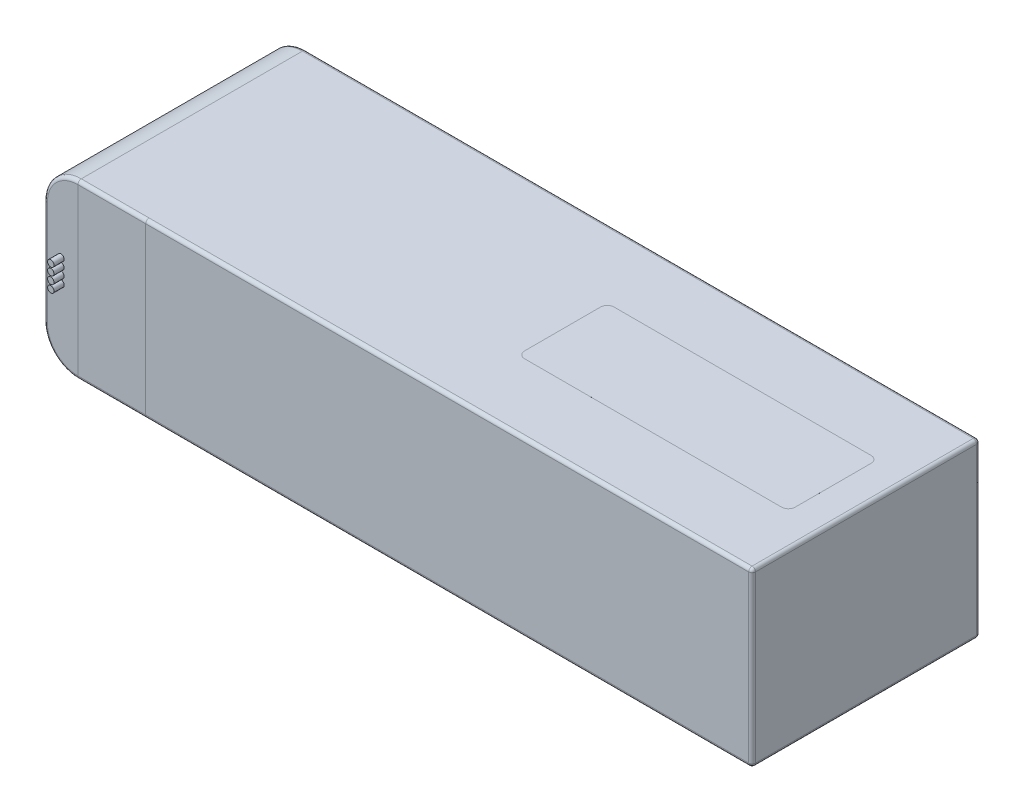
from build123d import *

# Parameters (mm, degrees)
SKETCH1_W           = 208.8
SKETCH1_H           = 67.2
BOSS_EXTRUDE1_DEPTH = 25.4
FILLET1_R           = 10
SKETCH2_R           = 1.9
BOSS_EXTRUDE2_DEPTH = 5
SKETCH4_R           = 0.95
BOSS_EXTRUDE3_DEPTH = 3
SKETCH5_W           = 20
SKETCH5_H           = 50.8
BOSS_EXTRUDE4_DEPTH = 0.0001
BOSS_EXTRUDE5_DEPTH = 0.0001
BOSS_EXTRUDE6_DEPTH = 0.0001
FILLET7_R           = 1
FILLET8_R           = 1


with BuildPart() as part:
    # Sketch1 → Boss-Extrude1 (new, symmetric)
    with BuildSketch(Plane(origin=(0, 0, 0), x_dir=(1, 0, 0), z_dir=(0, 1, 0))):
        Rectangle(SKETCH1_W, SKETCH1_H)
    extrude(amount=BOSS_EXTRUDE1_DEPTH, both=True)

    # Fillet1
    fillet1_edges = [part.edges().sort_by_distance(p)[0] for p in [
        (-104.4, 25.4, 0),
        (-104.4, -25.4, 0),
    ]]
    fillet(fillet1_edges, radius=FILLET1_R)

    # Sketch2 → Boss-Extrude2 (add)
    with BuildSketch(Plane(origin=(0, 0, -33.6), x_dir=(-1, 0, 0), z_dir=(0, 0, -1))):
        with Locations(Location((96.4, 3.35, 0), (0, 0, 180))):
            Circle(SKETCH2_R)
        with Locations(Location((96.4, -3.35, 0), (0, 0, 180))):
            Circle(SKETCH2_R)
    extrude(amount=BOSS_EXTRUDE2_DEPTH)

    # Sketch4 → Boss-Extrude3 (add)
    with BuildSketch(Plane.XY.offset(33.6)):
        with Locations(Location((-99.4, 3.3, 0), (0, 0, 180))):
            Circle(SKETCH4_R)
        with Locations(Location((-99.4, 1.1, 0), (0, 0, 180))):
            Circle(SKETCH4_R)
        with Locations(Location((-99.4, -1.1, 0), (0, 0, 180))):
            Circle(SKETCH4_R)
        with Locations(Location((-99.4, -3.3, 0), (0, 0, 180))):
            Circle(SKETCH4_R)
    extrude(amount=BOSS_EXTRUDE3_DEPTH)

    # Sketch5 → Boss-Extrude4 (add)
    with BuildSketch(Plane.XY.offset(33.6)):
        with Locations((-84.4, 0)):
            Rectangle(SKETCH5_W, SKETCH5_H)
    boss_extrude4 = extrude(amount=BOSS_EXTRUDE4_DEPTH)

    # Mirror1: Boss-Extrude4 across plane
    add(boss_extrude4.mirror(Plane.XY))

    # Mirror1 at the second plane: Boss-Extrude4 across plane
    add(boss_extrude4.mirror(Plane.ZX))

    # Sketch6 → Boss-Extrude5 (add)
    with BuildSketch(Plane(origin=(0, 25.4, 0), x_dir=(1, 0, 0), z_dir=(0, 1, 0))):
        with BuildLine():
            Line((16.9, 13.2), (92.7, 13.2))
            ThreePointArc((92.7, 13.2), (94.114213562, 12.614213562), (94.7, 11.2))
            Line((94.7, 11.2), (94.7, -11.2))
            ThreePointArc((94.7, -11.2), (94.114213562, -12.614213562), (92.7, -13.2))
            Line((92.7, -13.2), (16.9, -13.2))
            ThreePointArc((16.9, -13.2), (15.485786438, -12.614213562), (14.9, -11.2))
            Line((14.9, -11.2), (14.9, 11.2))
            ThreePointArc((14.9, 11.2), (15.485786438, 12.614213562), (16.9, 13.2))
        make_face()
    extrude(amount=BOSS_EXTRUDE5_DEPTH)

    # Sketch7 → Boss-Extrude6 (add)
    with BuildSketch(Plane.XZ.offset(25.4)):
        with BuildLine():
            Line((28.8, 12.5), (79.7, 12.5))
            ThreePointArc((79.7, 12.5), (81.114213562, 11.914213562), (81.7, 10.5))
            Line((81.7, 10.5), (81.7, -10.5))
            ThreePointArc((81.7, -10.5), (81.114213562, -11.914213562), (79.7, -12.5))
            Line((79.7, -12.5), (28.8, -12.5))
            ThreePointArc((28.8, -12.5), (27.385786438, -11.914213562), (26.8, -10.5))
            Line((26.8, -10.5), (26.8, 10.5))
            ThreePointArc((26.8, 10.5), (27.385786438, 11.914213562), (28.8, 12.5))
        make_face()
    extrude(amount=BOSS_EXTRUDE6_DEPTH)

    # Fillet7
    fillet7_edges = [part.edges().sort_by_distance(p)[0] for p in [
        (104.4, 25.4, 0),
        (-104.4, 0, 33.6),
        (-104.4, 0, -33.6),
        (15, 25.4, -33.6),
        (-101.471067812, 22.471067812, 33.6),
        (-101.471067812, -22.471067812, 33.6),
        (-101.471067812, 22.471067812, -33.6),
        (-101.471067812, -22.471067812, -33.6),
        (15, -25.4, -33.6),
        (104.4, -25.4, 0),
        (15, -25.4, 33.6),
        (15, 25.4, 33.6),
        (104.4, 0, -33.6),
        (104.4, 0, 33.6),
    ]]
    fillet(fillet7_edges, radius=FILLET7_R)

    # Fillet8
    fillet8_edges = [part.edges().sort_by_distance(p)[0] for p in [
        (-84.4, -25.4, 33.6001),
        (-84.4, 25.4, 33.6001),
        (-84.4, 25.4, -33.6001),
        (-84.4, -25.4, -33.6001),
    ]]
    fillet(fillet8_edges, radius=FILLET8_R)


solid = part.part
